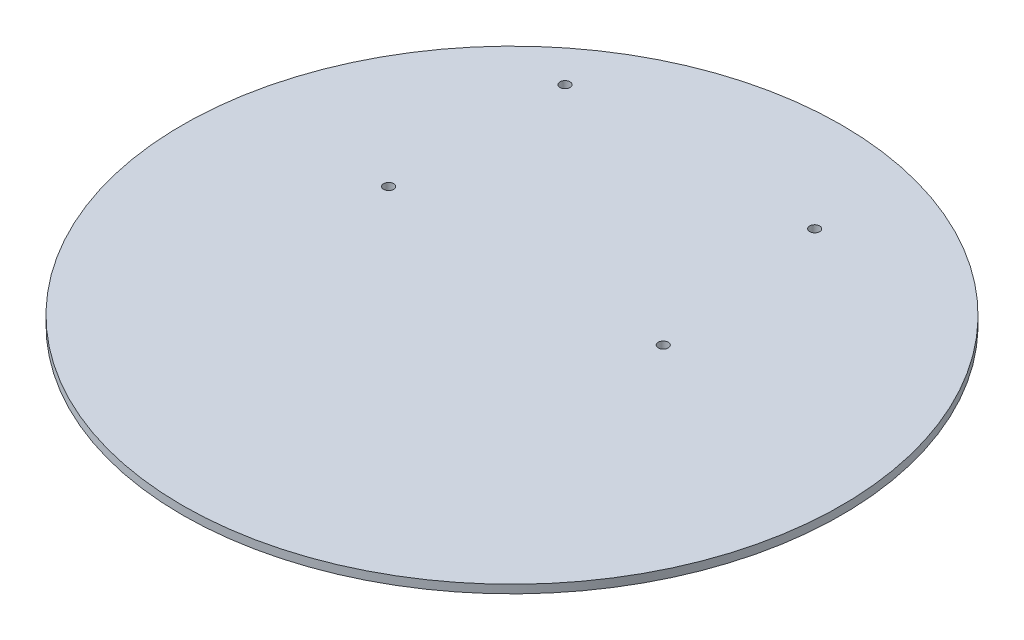
from build123d import *

# Parameters (mm, degrees)
SKETCH1_R           = 99
BOSS_EXTRUDE1_DEPTH = 2.5
SKETCH2_R           = 96.5
CUT_EXTRUDE1_DEPTH  = 2.5
SKETCH3_R           = 96.5
SKETCH3_R_2         = 1.5
BOSS_EXTRUDE3_DEPTH = 2.5


with BuildPart() as part:
    # Sketch1 → Boss-Extrude1 (new body)
    with BuildSketch(Plane(origin=(0, 0, 0), x_dir=(1, 0, 0), z_dir=(0, 1, 0))):
        with Locations(Location((0, 0, 0), (0, 0, 270))):
            Circle(SKETCH1_R)
    extrude(amount=BOSS_EXTRUDE1_DEPTH)

    # Sketch2 → Cut-Extrude1 (cut)
    with BuildSketch(Plane(origin=(0, 2.5, 0), x_dir=(1, 0, 0), z_dir=(0, 1, 0))):
        with Locations(Location((0, 0, 0), (0, 0, 270))):
            Circle(SKETCH2_R)
    extrude(amount=-CUT_EXTRUDE1_DEPTH, mode=Mode.SUBTRACT)

    # Sketch3 → Boss-Extrude3 (add)
    with BuildSketch(Plane(origin=(0, 2.5, 0), x_dir=(1, 0, 0), z_dir=(0, 1, 0))):
        Circle(SKETCH3_R)
        with Locations(Location((-52.01148814, 14.941708329, 0), (0, 0, 270))):
            Circle(SKETCH3_R_2, mode=Mode.SUBTRACT)
        with Locations(Location((-52.01148814, 67.941708329, 0), (0, 0, 270))):
            Circle(SKETCH3_R_2, mode=Mode.SUBTRACT)
        with Locations(Location((22.98851186, 67.941708329, 0), (0, 0, 270))):
            Circle(SKETCH3_R_2, mode=Mode.SUBTRACT)
        with Locations(Location((30.48851186, 14.941708329, 0), (0, 0, 270))):
            Circle(SKETCH3_R_2, mode=Mode.SUBTRACT)
    extrude(amount=-BOSS_EXTRUDE3_DEPTH)


solid = part.part
